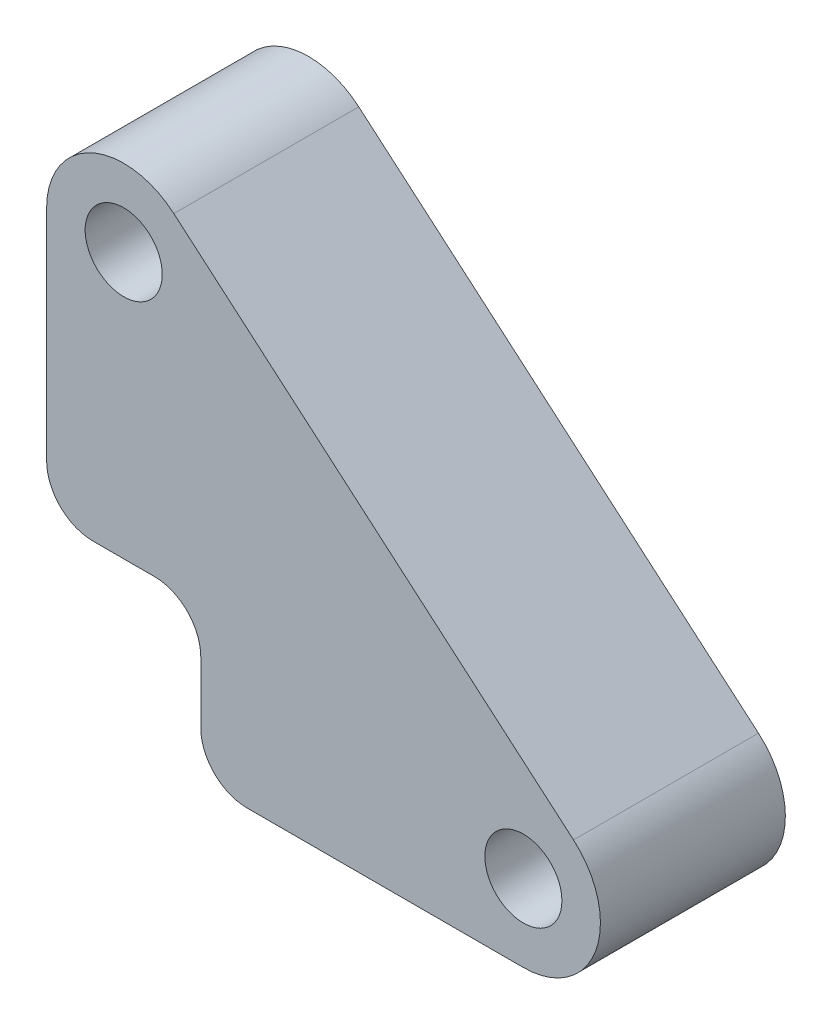
from build123d import *

# Parameters (mm, degrees)
BOSS_EXTRUDE1_DEPTH = 24
SKETCH2_R           = 5
CUT_EXTRUDE1_DEPTH  = 100.477304276
CUT_EXTRUDE2_DEPTH  = 100.477304276
FILLET1_R           = 6


with BuildPart() as part:
    # Sketch1 → Boss-Extrude1 (new body)
    with BuildSketch(Plane.XY):
        with BuildLine():
            Line((0, 10), (0, 54.457793632))
            ThreePointArc((0, 54.457793632), (5.821431905, 63.542922617), (16.507913735, 62.050359656))
            Line((16.507913735, 62.050359656), (68.375339639, 17.592566024))
            ThreePointArc((68.375339639, 17.592566024), (71.246276054, 6.530537523), (61.867425905, 0))
            Line((61.867425905, 0), (10, 0))
            ThreePointArc((10, 0), (2.928932188, 2.928932188), (0, 10))
        make_face()
    extrude(amount=BOSS_EXTRUDE1_DEPTH)

    # Sketch2 → Cut-Extrude1 (cut, through all)
    with BuildSketch(Plane.XY.offset(24)):
        with Locations((10, 54.457793632)):
            Circle(SKETCH2_R)
        with Locations((61.867425905, 10)):
            Circle(SKETCH2_R)
    extrude(amount=-CUT_EXTRUDE1_DEPTH, mode=Mode.SUBTRACT)

    # Sketch3 → Cut-Extrude2 (cut, through all)
    with BuildSketch(Plane(origin=(0, 0, 0), x_dir=(-1, 0, 0), z_dir=(0, 0, -1))):
        with BuildLine():
            Line((0, 0), (-20, 0))
            Line((-20, 0), (-20, 14))
            ThreePointArc((-20, 14), (-18.242640687, 18.242640687), (-14, 20))
            Line((-14, 20), (0, 20))
            Line((0, 20), (0, 0))
        make_face()
    extrude(amount=-CUT_EXTRUDE2_DEPTH, mode=Mode.SUBTRACT)

    # Fillet1
    fillet1_edges = [part.edges().sort_by_distance(p)[0] for p in [
        (0, 20, 12),
        (20, 0, 12),
    ]]
    fillet(fillet1_edges, radius=FILLET1_R)


solid = part.part
